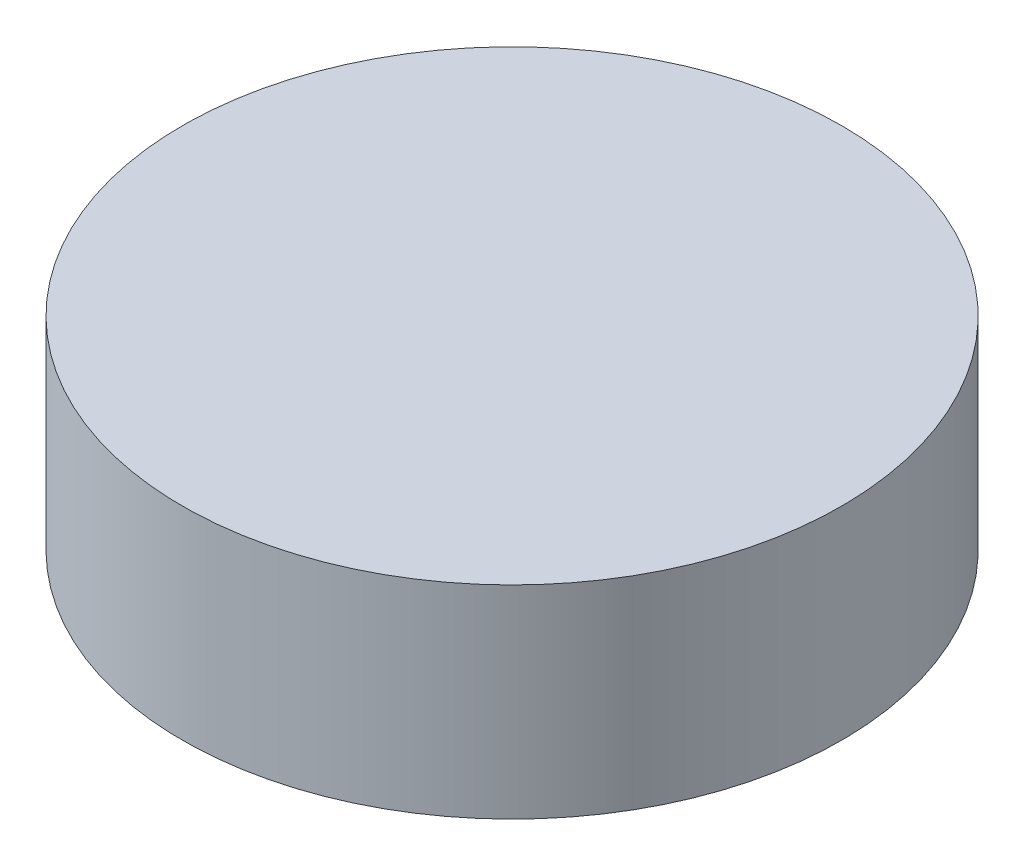
from build123d import *

# Parameters (mm, degrees)
SKETCH_1_W = 6.5
SKETCH_1_H = 4


with BuildPart() as part:
    # 草图1 → Revolve 2 (revolve)
    with BuildSketch(Plane.XY, mode=Mode.PRIVATE) as revolve_2_sk:
        with Locations((3.25, 2)):
            Rectangle(SKETCH_1_W, SKETCH_1_H)
    revolve(revolve_2_sk.sketch.rotate(Axis((0, 0, 0), (0, 1, 0)), 90), axis=Axis((0, 0, 0), (0, 1, 0)))


solid = part.part
